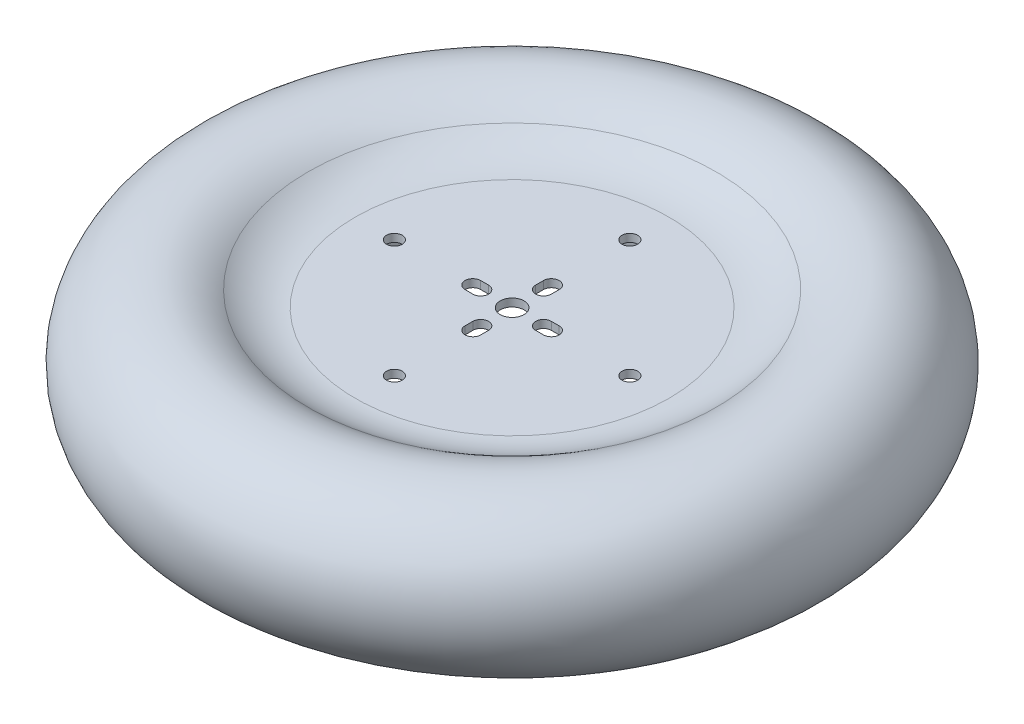
from build123d import *

# Parameters (mm, degrees)
SKETCH2_R          = 5
SKETCH2_R_2        = 7.596705921
CUT_EXTRUDE2_DEPTH = 10


with BuildPart() as part:
    # Sketch1 → Revolve1 (revolve)
    with BuildSketch(Plane.XY):
        with BuildLine():
            Line((-85, 25), (0, 25))
            Line((0, 25), (0, 30))
            Line((0, 30), (-100, 30))
            ThreePointArc((-100, 30), (-115.811388301, 32.565835097), (-130, 40))
            ThreePointArc((-130, 40), (-204.72135955, -22.360679775), (-110, 0))
            ThreePointArc((-110, 0), (-102.67766953, 17.67766953), (-85, 25))
        make_face()
    revolve(axis=Axis((0, 30, 0), (0, -1, 0)))

    # Sketch2 → Cut-Extrude2 (cut)
    with BuildSketch(Plane(origin=(0, 30, 0), x_dir=(1, 0, 0), z_dir=(0, 1, 0))):
        with BuildLine():
            Line((-5, 25), (-5, 20))
            ThreePointArc((-5, 20), (0, 15), (5, 20))
            Line((5, 20), (5, 25))
            ThreePointArc((5, 25), (0, 30), (-5, 25))
        make_face()
        with BuildLine():
            Line((25, 5), (20, 5))
            ThreePointArc((20, 5), (15, 0), (20, -5))
            Line((20, -5), (25, -5))
            ThreePointArc((25, -5), (30, 0), (25, 5))
        make_face()
        with BuildLine():
            Line((5, -25), (5, -20))
            ThreePointArc((5, -20), (0, -15), (-5, -20))
            Line((-5, -20), (-5, -25))
            ThreePointArc((-5, -25), (0, -30), (5, -25))
        make_face()
        with BuildLine():
            Line((-25, -5), (-20, -5))
            ThreePointArc((-20, -5), (-15, 0), (-20, 5))
            Line((-20, 5), (-25, 5))
            ThreePointArc((-25, 5), (-30, 0), (-25, -5))
        make_face()
        with Locations((0, 75)):
            Circle(SKETCH2_R)
        Circle(SKETCH2_R_2)
        with Locations((75, 0)):
            Circle(SKETCH2_R)
        with Locations((0, -75)):
            Circle(SKETCH2_R)
        with Locations((-75, 0)):
            Circle(SKETCH2_R)
    extrude(amount=-CUT_EXTRUDE2_DEPTH, mode=Mode.SUBTRACT)


solid = part.part
